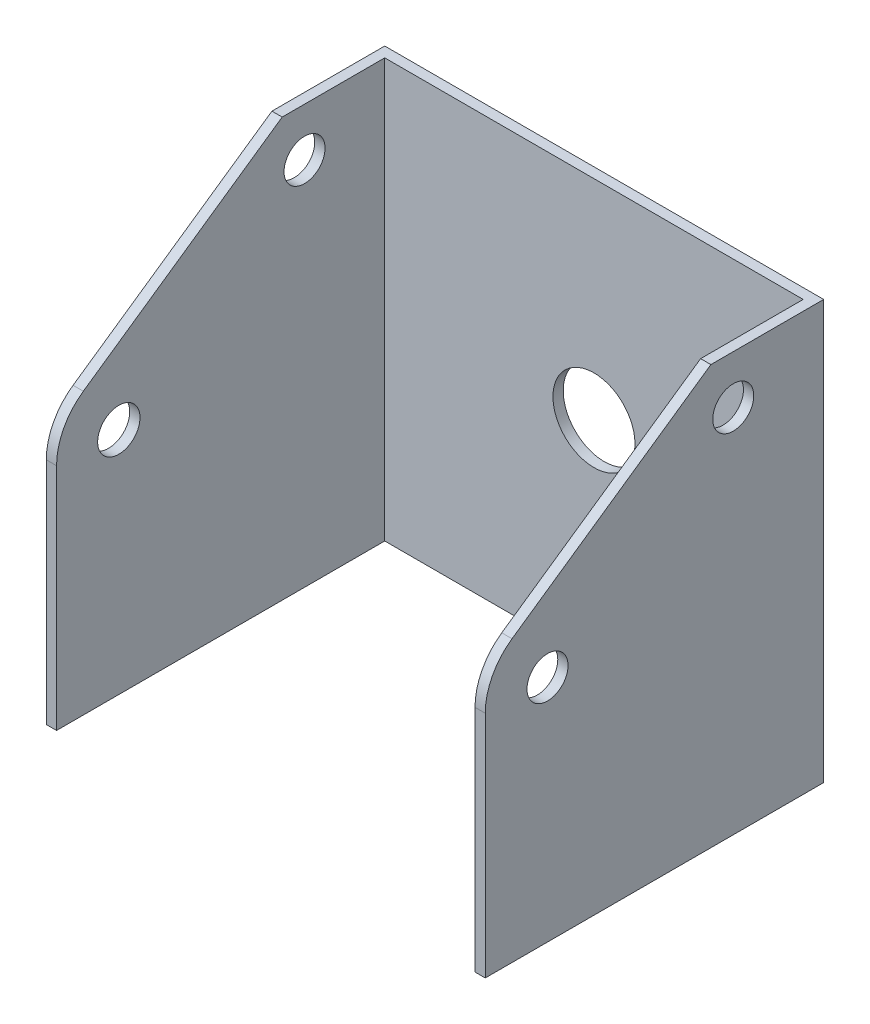
from build123d import *

# Parameters (mm, degrees)
SKETCH1_W           = 204
SKETCH1_H           = 204
SKETCH1_R           = 20
BOSS_EXTRUDE1_DEPTH = 5
SKETCH2_R           = 10
BOSS_EXTRUDE2_DEPTH = 5
BOSS_EXTRUDE3_START = 5
SKETCH3_R           = 10
SKETCH3_R_2         = 10.325688869
BOSS_EXTRUDE3_DEPTH = 5


with BuildPart() as part:
    # Sketch1 → Boss-Extrude1 (new body)
    with BuildSketch(Plane.XY):
        Rectangle(SKETCH1_W, SKETCH1_H)
        Circle(SKETCH1_R, mode=Mode.SUBTRACT)
    extrude(amount=BOSS_EXTRUDE1_DEPTH)

    # Sketch2 → Boss-Extrude2 (add)
    with BuildSketch(Plane(origin=(102, 0, 0), x_dir=(0, 0, -1), z_dir=(1, 0, 0))):
        with BuildLine():
            Line((0, 102), (-55, 102))
            Line((-55, 102), (-151.95068894, 34.723038836))
            ThreePointArc((-151.95068894, 34.723038836), (-161.540540881, 23.857555439), (-165, 9.784313725))
            Line((-165, 9.784313725), (-165, -102))
            Line((-165, -102), (-55, -102))
            Line((-55, -102), (0, -102))
            Line((0, -102), (0, 102))
        make_face()
        with Locations((-44.107183944, 78.450980392)):
            Circle(SKETCH2_R, mode=Mode.SUBTRACT)
        with Locations((-134.644967247, 9.784313725)):
            Circle(SKETCH2_R, mode=Mode.SUBTRACT)
    extrude(amount=BOSS_EXTRUDE2_DEPTH)

    # Sketch3 → Boss-Extrude3 (add)
    with BuildSketch(Plane.ZY.offset(102).offset(BOSS_EXTRUDE3_START)):
        with BuildLine():
            Line((0, 102), (0, -102))
            Line((0, -102), (165, -102))
            Line((165, -102), (165, 9.784313725))
            ThreePointArc((165, 9.784313725), (161.540540881, 23.857555439), (151.95068894, 34.723038836))
            Line((151.95068894, 34.723038836), (55, 102))
            Line((55, 102), (0, 102))
        make_face()
        with Locations(Location((44.107183944, 78.450980392, 0), (0, 0, 180))):
            Circle(SKETCH3_R, mode=Mode.SUBTRACT)
        with Locations((134.644967247, 9.784313725)):
            Circle(SKETCH3_R_2, mode=Mode.SUBTRACT)
    extrude(amount=-BOSS_EXTRUDE3_DEPTH)


solid = part.part
